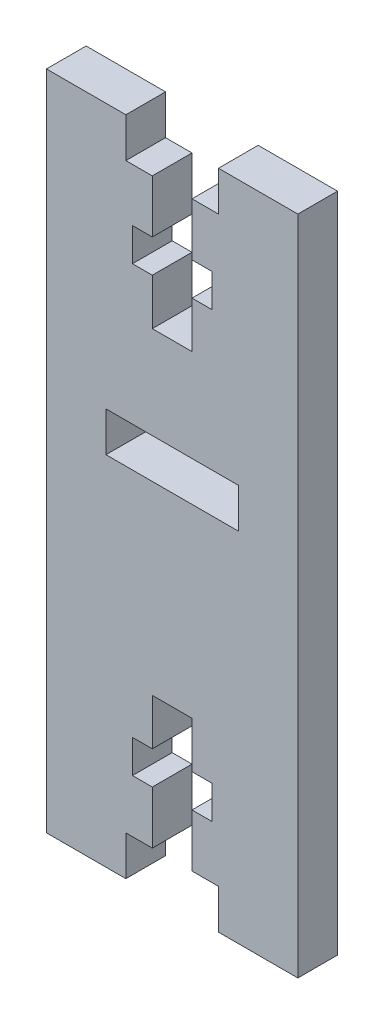
from build123d import *

# Parameters (mm, degrees)
ESQUISSE10_W        = 10
ESQUISSE10_H        = 3
BOSS_EXTRU_10_DEPTH = 3


with BuildPart() as part:
    # Esquisse10 → Boss.-Extru.10 (new body)
    with BuildSketch(Plane.XY):
        Polygon((-4.985718963, -60.476422657), (1.014281037, -60.476422657), (1.014281037, -110.476422657), (-4.985718963, -110.476422657), (-4.985718963, -107.476422657), (-6.985718963, -107.476422657), (-6.985718963, -103.476422657), (-5.485718963, -103.476422657), (-5.485718963, -100.976422657), (-6.985718963, -100.976422657), (-6.985718963, -97.476422657), (-9.985718963, -97.476422657), (-9.985718963, -100.976422657), (-11.485718963, -100.976422657), (-11.485718963, -103.476422657), (-9.985718963, -103.476422657), (-9.985718963, -107.476422657), (-11.985718963, -107.476422657), (-11.985718963, -110.476422657), (-17.985718963, -110.476422657), (-17.985718963, -60.476422657), (-11.985718963, -60.476422657), (-11.985718963, -63.476422657), (-9.985718963, -63.476422657), (-9.985718963, -67.476422657), (-11.485718963, -67.476422657), (-11.485718963, -69.976422657), (-9.985718963, -69.976422657), (-9.985718963, -73.476422657), (-6.985718963, -73.476422657), (-6.985718963, -69.976422657), (-5.485718963, -69.976422657), (-5.485718963, -67.476422657), (-6.985718963, -67.476422657), (-6.985718963, -63.476422657), (-4.985718963, -63.476422657), align=None)
        with Locations((-8.485718963, -81.976422657)):
            Rectangle(ESQUISSE10_W, ESQUISSE10_H, mode=Mode.SUBTRACT)
    extrude(amount=BOSS_EXTRU_10_DEPTH)


solid = part.part
